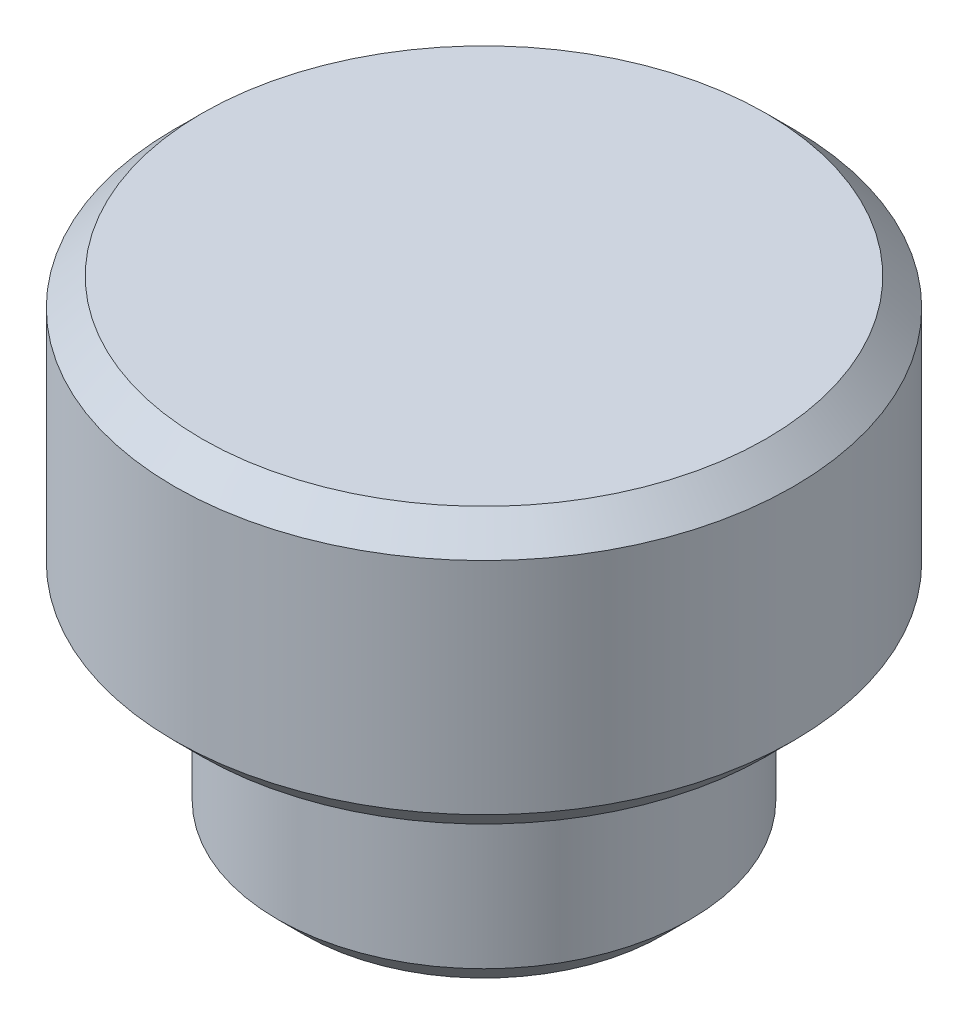
from build123d import *

# Parameters (mm, degrees)
SKETCH_1_R      = 3
EXTRUDE_1_DEPTH = 3
SKETCH_2_R      = 4.5
EXTRUDE_2_DEPTH = 4
CHAMFER_1_SIZE  = 0.4


with BuildPart() as part:
    # 草图1 → 凸台-拉伸1 (new body)
    with BuildSketch(Plane(origin=(0, 0, 0), x_dir=(1, 0, 0), z_dir=(0, 1, 0))):
        with Locations(Location((0, 0, 0), (0, 0, 270))):
            Circle(SKETCH_1_R)
    extrude(amount=EXTRUDE_1_DEPTH)

    # 草图2 → 凸台-拉伸2 (add)
    with BuildSketch(Plane(origin=(0, 3, 0), x_dir=(1, 0, 0), z_dir=(0, 1, 0))):
        with Locations(Location((0, 0, 0), (0, 0, 270))):
            Circle(SKETCH_2_R)
    extrude(amount=EXTRUDE_2_DEPTH)

    # 倒角1
    chamfer_1_edges = [part.edges().sort_by_distance(p)[0] for p in [
        (0, 0, -3),
        (0, 3, -3),
        (0, 3, -4.5),
        (0, 7, -4.5),
    ]]
    chamfer(chamfer_1_edges, length=CHAMFER_1_SIZE)


solid = part.part
